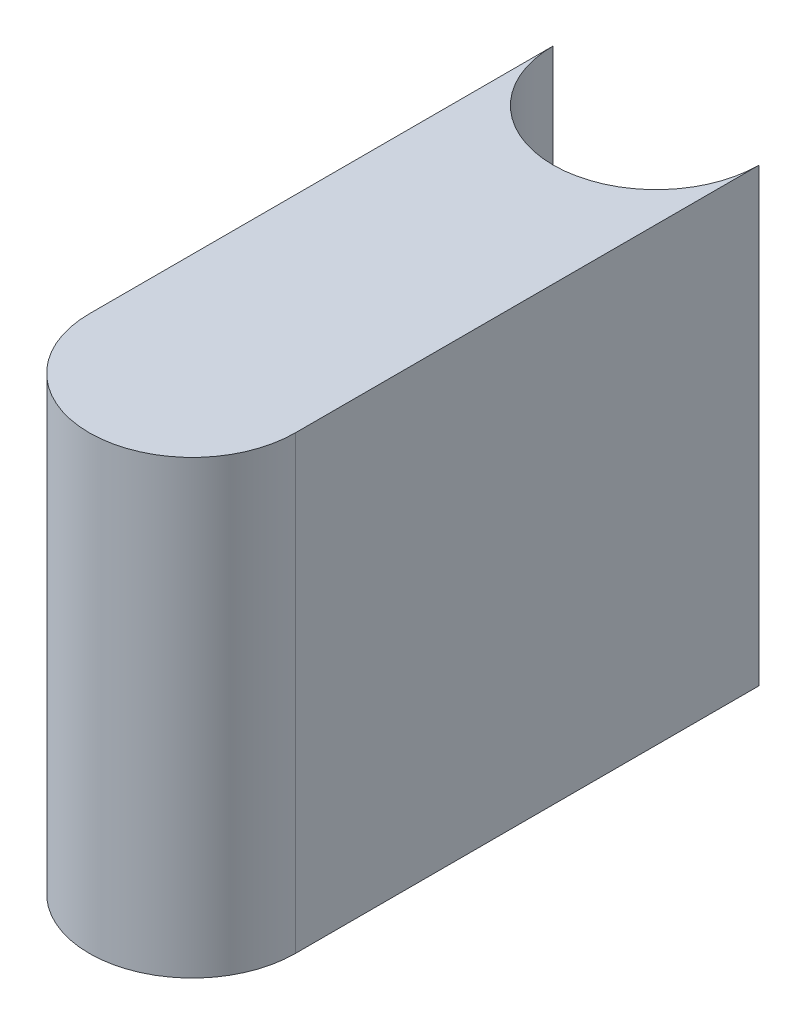
from build123d import *

# Parameters (mm, degrees)
BOSS_EXTRUDE1_DEPTH = 350


with BuildPart() as part:
    # Sketch1 → Boss-Extrude1 (new body)
    with BuildSketch(Plane(origin=(0, 0, 0), x_dir=(1, 0, 0), z_dir=(0, 1, 0))):
        with BuildLine():
            Line((-90.341406563, 354.111123331), (-90.341406563, -5.888876669))
            ThreePointArc((-90.341406563, -5.888876669), (-10.341406563, -85.888876669), (69.658593437, -5.888876669))
            Line((69.658593437, -5.888876669), (69.658593437, 354.111123331))
            ThreePointArc((69.658593437, 354.111123331), (-10.341406563, 274.111123331), (-90.341406563, 354.111123331))
        make_face()
    extrude(amount=BOSS_EXTRUDE1_DEPTH)


solid = part.part
